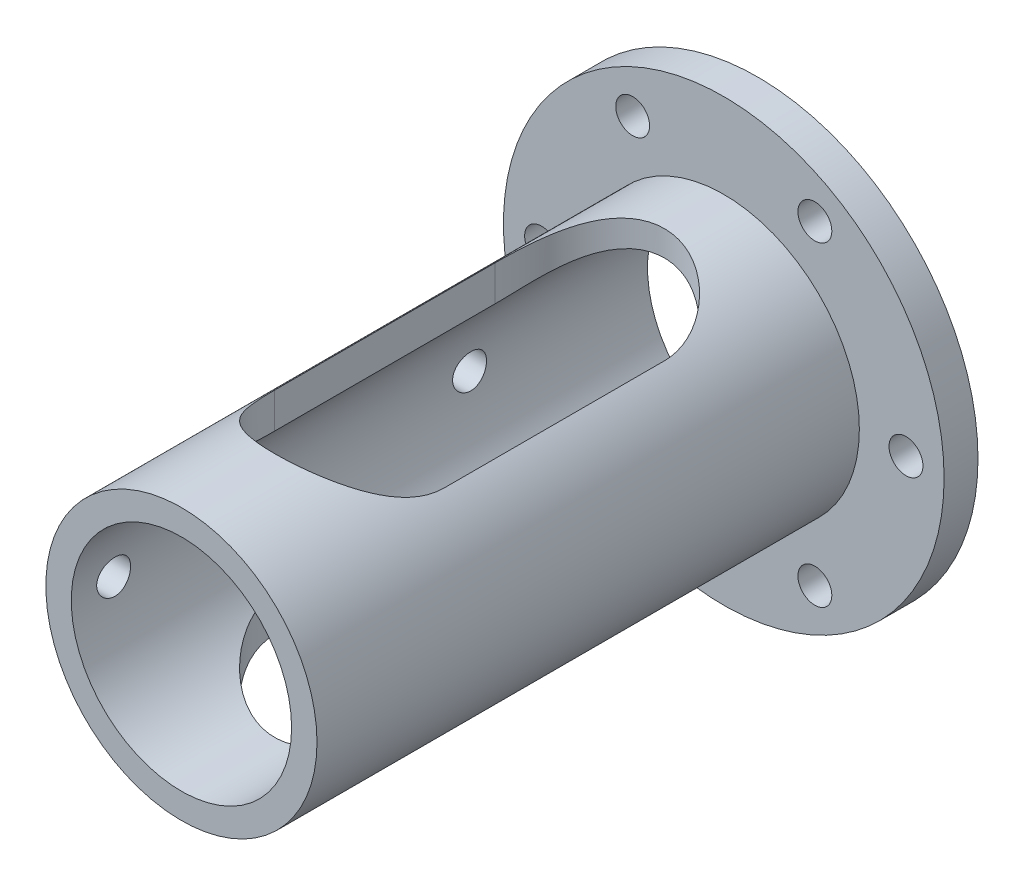
from build123d import *

# Parameters (mm, degrees)
SKETCH1_R           = 26
SKETCH1_R_2         = 13
SKETCH1_R_3         = 2
BOSS_EXTRUDE1_DEPTH = 4
SKETCH2_R           = 16
SKETCH2_R_2         = 13
BOSS_EXTRUDE2_DEPTH = 64
CUT_EXTRUDE1_DEPTH  = 32
SKETCH4_R           = 2
CUT_EXTRUDE2_DEPTH  = 64


with BuildPart() as part:
    # Sketch1 → Boss-Extrude1 (new body)
    with BuildSketch(Plane.XY):
        Circle(SKETCH1_R)
        Circle(SKETCH1_R_2, mode=Mode.SUBTRACT)
        with Locations((-21.5, 0)):
            Circle(SKETCH1_R_3, mode=Mode.SUBTRACT)
        with Locations((-10.75, 18.619546181)):
            Circle(SKETCH1_R_3, mode=Mode.SUBTRACT)
        with Locations((10.75, 18.619546181)):
            Circle(SKETCH1_R_3, mode=Mode.SUBTRACT)
        with Locations((21.5, 0)):
            Circle(SKETCH1_R_3, mode=Mode.SUBTRACT)
        with Locations((10.75, -18.619546181)):
            Circle(SKETCH1_R_3, mode=Mode.SUBTRACT)
        with Locations((-10.75, -18.619546181)):
            Circle(SKETCH1_R_3, mode=Mode.SUBTRACT)
    extrude(amount=BOSS_EXTRUDE1_DEPTH)

    # Sketch2 → Boss-Extrude2 (add)
    with BuildSketch(Plane.XY.offset(4)):
        Circle(SKETCH2_R)
        Circle(SKETCH2_R_2, mode=Mode.SUBTRACT)
    extrude(amount=BOSS_EXTRUDE2_DEPTH)

    # Sketch3 → Cut-Extrude1 (cut, symmetric)
    with BuildSketch(Plane(origin=(0, 0, 0), x_dir=(1, 0, 0), z_dir=(0, 1, 0))):
        with BuildLine():
            Line((10, -21), (10, -47))
            ThreePointArc((10, -47), (0, -57), (-10, -47))
            Line((-10, -47), (-10, -21))
            ThreePointArc((-10, -21), (0, -11), (10, -21))
        make_face()
    extrude(amount=CUT_EXTRUDE1_DEPTH, both=True, mode=Mode.SUBTRACT)

    # Sketch4 → Cut-Extrude2 (cut)
    with BuildSketch(Plane(origin=(0, 0, 0), x_dir=(0, 0, -1), z_dir=(1, 0, 0))):
        with Locations(Location((-21, 0, 0), (0, 0, 180))):
            Circle(SKETCH4_R)
        with Locations(Location((-63, 0, 0), (0, 0, 180))):
            Circle(SKETCH4_R)
    extrude(amount=-CUT_EXTRUDE2_DEPTH, mode=Mode.SUBTRACT)


solid = part.part
